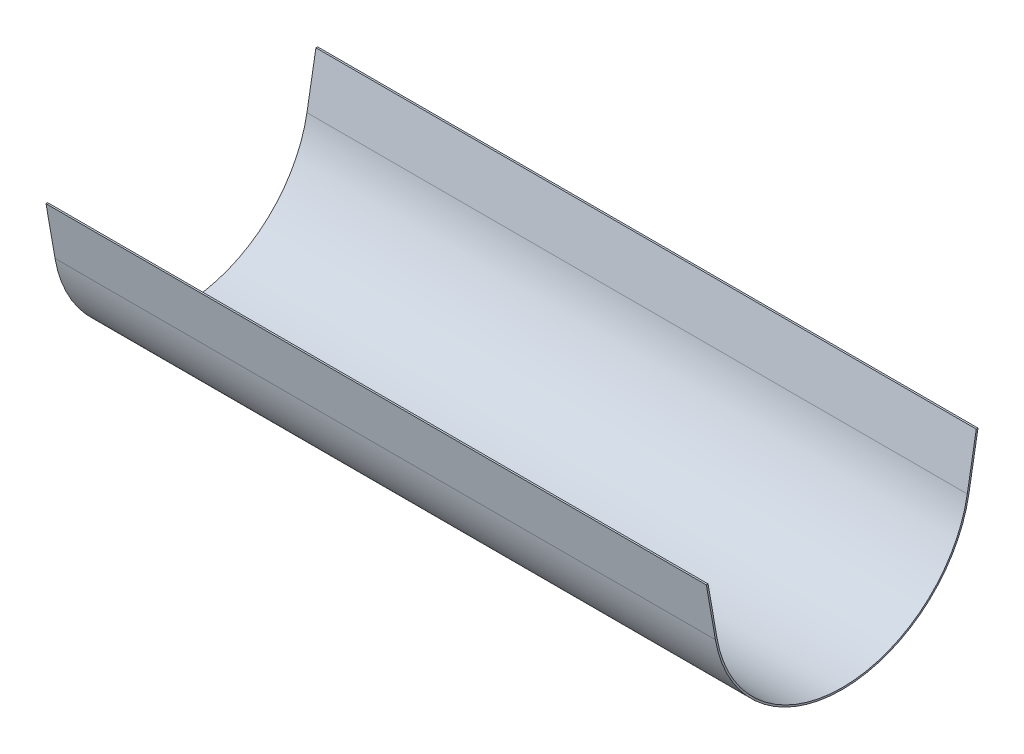
from build123d import *

# Parameters (mm, degrees)
BOSS_EXTRUDE1_DEPTH = 195


with BuildPart() as part:
    # Sketch1 → Boss-Extrude1 (new, symmetric)
    with BuildSketch(Plane(origin=(0, 0, 0), x_dir=(0, 0, -1), z_dir=(1, 0, 0))):
        with BuildLine():
            Line((-80.21, 0), (-74.877666329, -30.682881508))
            ThreePointArc((-74.877666329, -30.682881508), (0, -93.67), (74.877666329, -30.682881508))
            Line((74.877666329, -30.682881508), (80.21, 0))
            Line((80.21, 0), (79.195011102, 0))
            Line((79.195011102, 0), (73.892433877, -30.511659383))
            ThreePointArc((73.892433877, -30.511659383), (0, -92.67), (-73.892433877, -30.511659383))
            Line((-73.892433877, -30.511659383), (-79.195011102, 0))
            Line((-79.195011102, 0), (-80.21, 0))
        make_face()
    extrude(amount=BOSS_EXTRUDE1_DEPTH, both=True)


solid = part.part
